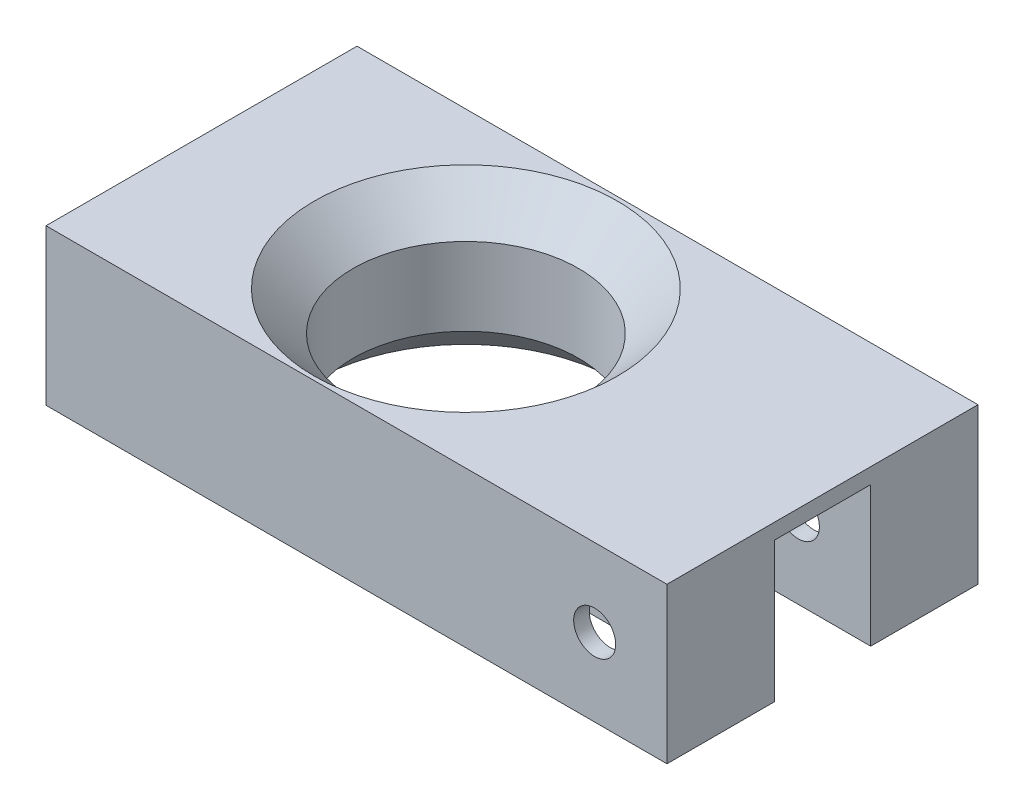
from build123d import *

# Parameters (mm, degrees)
BOSS_EXTRUDE2_DEPTH = 10
SKETCH2_R           = 7.25
CUT_EXTRUDE1_DEPTH  = 10
CHAMFER5_SIZE       = 2.5
SKETCH5_W           = 6.2
SKETCH5_H           = 2
BOSS_EXTRUDE3_DEPTH = 8.5
SKETCH6_W           = 2.931408159
SKETCH6_H           = 6.9
BOSS_EXTRUDE4_DEPTH = 10
SKETCH7_W           = 8.5
SKETCH7_H           = 6.2
CUT_EXTRUDE2_DEPTH  = 1
SKETCH8_R           = 1.35
CUT_EXTRUDE3_DEPTH  = 20
BOSS_EXTRUDE5_START = -10
BOSS_EXTRUDE5_DEPTH = 10
SKETCH12_W          = 20
SKETCH12_H          = 10
SKETCH12_W_2        = 18
SKETCH12_H_2        = 8
BOSS_EXTRUDE7_DEPTH = 12
CUT_EXTRUDE4_DEPTH  = 9
SKETCH15_W          = 20
SKETCH15_H          = 10
SKETCH15_W_2        = 18
SKETCH15_H_2        = 8
CUT_EXTRUDE5_DEPTH  = 5


with BuildPart() as part:
    # Sketch1 → Boss-Extrude2 (new body)
    with BuildSketch(Plane(origin=(0, 0, 0), x_dir=(1, 0, 0), z_dir=(0, 1, 0))):
        with BuildLine():
            Line((-1.149759624, -19.701544489), (-21.149759624, -19.701544489))
            ThreePointArc((-21.149759624, -19.701544489), (-31.149759624, -29.70154451), (-21.149759581, -39.701544489))
            Line((-21.149759581, -39.701544489), (-1.149759624, -39.701544489))
            Line((-1.149759624, -39.701544489), (-1.149759624, -32.801544489))
            Line((-1.149759624, -32.801544489), (-6.718351465, -32.801544489))
            Line((-6.718351465, -32.801544489), (-6.718351465, -26.601544489))
            Line((-6.718351465, -26.601544489), (-1.149759624, -26.601544489))
            Line((-1.149759624, -26.601544489), (-1.149759624, -19.701544489))
        make_face()
    extrude(amount=BOSS_EXTRUDE2_DEPTH)

    # Sketch2 → Cut-Extrude1 (cut)
    with BuildSketch(Plane(origin=(0, 10, 0), x_dir=(1, 0, 0), z_dir=(0, 1, 0))):
        with Locations((-21.149759624, -29.701544489)):
            Circle(SKETCH2_R)
    extrude(amount=-CUT_EXTRUDE1_DEPTH, mode=Mode.SUBTRACT)

    # Chamfer5
    chamfer5_edges = [part.edges().sort_by_distance(p)[0] for p in [
        (-28.399759624, 10, 29.701544489),
        (-28.399759624, 0, 29.701544489),
    ]]
    chamfer(chamfer5_edges, length=CHAMFER5_SIZE)

    # Sketch5 → Boss-Extrude3 (add)
    with BuildSketch(Plane(origin=(-6.718351465, 0, 0), x_dir=(0, 0, -1), z_dir=(1, 0, 0))):
        with Locations((-29.701544489, 9)):
            Rectangle(SKETCH5_W, SKETCH5_H)
    extrude(amount=BOSS_EXTRUDE3_DEPTH)

    # Sketch6 → Boss-Extrude4 (add)
    with BuildSketch(Plane(origin=(0, 10, 0), x_dir=(1, 0, 0), z_dir=(0, 1, 0))):
        with Locations((0.315944456, -23.151544489)):
            Rectangle(SKETCH6_W, SKETCH6_H)
        with Locations((0.315944456, -36.251544489)):
            Rectangle(SKETCH6_W, SKETCH6_H)
    extrude(amount=-BOSS_EXTRUDE4_DEPTH)

    # Sketch7 → Cut-Extrude2 (cut)
    with BuildSketch(Plane.XZ.offset(-8)):
        with Locations((-2.468351465, 29.701544489)):
            Rectangle(SKETCH7_W, SKETCH7_H)
    extrude(amount=-CUT_EXTRUDE2_DEPTH, mode=Mode.SUBTRACT)

    # Sketch8 → Cut-Extrude3 (cut)
    with BuildSketch(Plane.XY.offset(39.701544489)):
        with Locations((-2.868351465, 5)):
            Circle(SKETCH8_R)
    extrude(amount=-CUT_EXTRUDE3_DEPTH, mode=Mode.SUBTRACT)

    # Sketch10 → Boss-Extrude5 (add)
    with BuildSketch(Plane(origin=(0, 10, 0), x_dir=(1, 0, 0), z_dir=(0, 1, 0)).offset(BOSS_EXTRUDE5_START)):
        with BuildLine():
            ThreePointArc((-31.149759624, -29.701544489), (-28.220827436, -22.630476677), (-21.149759624, -19.701544489))
            Line((-21.149759624, -19.701544489), (-31.149759624, -19.701544489))
            Line((-31.149759624, -19.701544489), (-31.149759624, -29.701544489))
        make_face()
        with BuildLine():
            ThreePointArc((-21.149759624, -39.701544489), (-28.220827436, -36.772612301), (-31.149759624, -29.701544489))
            Line((-31.149759624, -29.701544489), (-31.149759624, -39.701544489))
            Line((-31.149759624, -39.701544489), (-21.149759624, -39.701544489))
        make_face()
    extrude(amount=BOSS_EXTRUDE5_DEPTH)

    # Sketch12 → Boss-Extrude7 (add)
    with BuildSketch(Plane.ZY.offset(31.149759624)):
        with Locations((29.701544489, 5)):
            Rectangle(SKETCH12_W, SKETCH12_H)
        with Locations((29.701544489, 5)):
            Rectangle(SKETCH12_W_2, SKETCH12_H_2, mode=Mode.SUBTRACT)
    extrude(amount=BOSS_EXTRUDE7_DEPTH)

    # Sketch13 → Cut-Extrude4 (cut)
    with BuildSketch(Plane.XZ):
        Polygon((0.781648535, 33.801544489), (0.781648535, 38.701544489), (-13.850581564, 38.701544489), (-10.149759624, 33.801544489), align=None)
        Polygon((0.781648535, 20.701544489), (0.781648535, 25.601544489), (-10.149759624, 25.601544489), (-13.850581564, 20.701544489), align=None)
    extrude(amount=-CUT_EXTRUDE4_DEPTH, mode=Mode.SUBTRACT)

    # Sketch15 → Cut-Extrude5 (cut)
    with BuildSketch(Plane.ZY.offset(43.149759624)):
        with Locations((29.701544489, 5)):
            Rectangle(SKETCH15_W, SKETCH15_H)
        with Locations((29.701544489, 5)):
            Rectangle(SKETCH15_W_2, SKETCH15_H_2, mode=Mode.SUBTRACT)
    extrude(amount=-CUT_EXTRUDE5_DEPTH, mode=Mode.SUBTRACT)


solid = part.part
